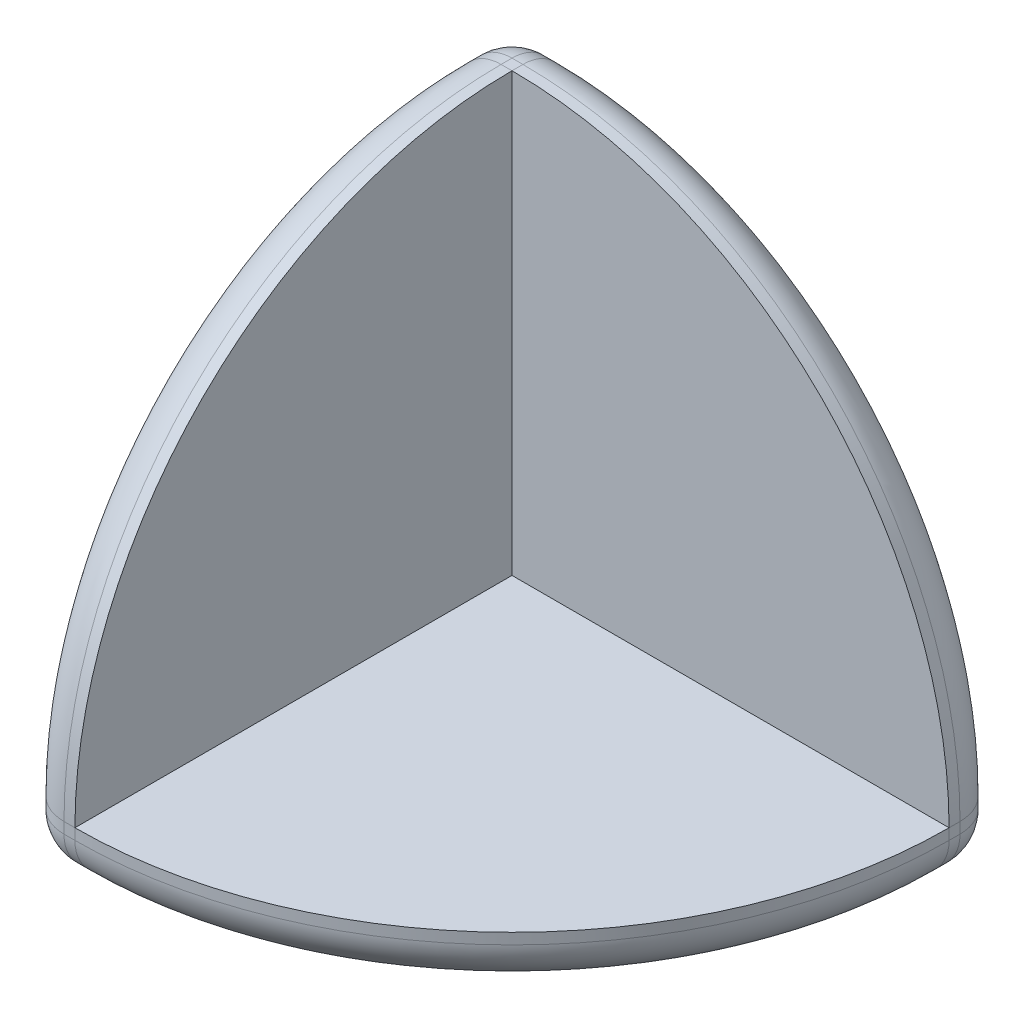
from build123d import *

# Parameters (mm, degrees)
BOSS_EXTRUDE1_DEPTH = 3.175
SKETCH2_W           = 25.4
SKETCH2_H           = 3.175
BOSS_EXTRUDE2_DEPTH = 3.175
BOSS_EXTRUDE3_DEPTH = 3.175
FILLET1_R           = 2.54


with BuildPart() as part:
    # Sketch1 → Boss-Extrude1 (new body)
    with BuildSketch(Plane.XY):
        Polygon((-3.175, -3.175), (25.4, -3.175), (25.4, 0), (0, 0), (0, 25.4), (-3.175, 25.4), align=None)
        with BuildLine():
            Line((0, 0), (25.4, 0))
            ThreePointArc((25.4, 0), (17.960512242, 17.960512242), (0, 25.4))
            Line((0, 25.4), (0, 0))
        make_face()
    extrude(amount=BOSS_EXTRUDE1_DEPTH)

    # Sketch2 → Boss-Extrude2 (add)
    with BuildSketch(Plane.ZY.offset(3.175)):
        with Locations((15.875, -1.5875)):
            Rectangle(SKETCH2_W, SKETCH2_H)
        with BuildLine():
            ThreePointArc((28.575, 0), (21.135512242, 17.960512242), (3.175, 25.4))
            Line((3.175, 25.4), (3.175, 0))
            Line((3.175, 0), (28.575, 0))
        make_face()
    extrude(amount=-BOSS_EXTRUDE2_DEPTH)

    # Sketch5 → Boss-Extrude3 (add)
    with BuildSketch(Plane.XZ.offset(3.175)):
        with BuildLine():
            Line((0, 28.575), (0, 3.175))
            Line((0, 3.175), (25.4, 3.175))
            ThreePointArc((25.4, 3.175), (17.960512242, 21.135512242), (0, 28.575))
        make_face()
    extrude(amount=-BOSS_EXTRUDE3_DEPTH)

    # Fillet1
    fillet1_edges = [part.edges().sort_by_distance(p)[0] for p in [
        (25.4, -3.175, 1.5875),
        (-3.175, -3.175, 14.2875),
        (-3.175, 25.4, 1.5875),
        (-1.5875, -3.175, 28.575),
        (-3.175, -1.5875, 28.575),
        (-3.175, 17.960512242, 21.135512242),
        (17.960512242, -3.175, 21.135512242),
        (11.1125, -3.175, 0),
        (-3.175, 11.1125, 0),
        (-1.5875, 25.4, 0),
        (17.960512242, 17.960512242, 0),
        (25.4, -1.5875, 0),
    ]]
    fillet(fillet1_edges, radius=FILLET1_R)


solid = part.part
